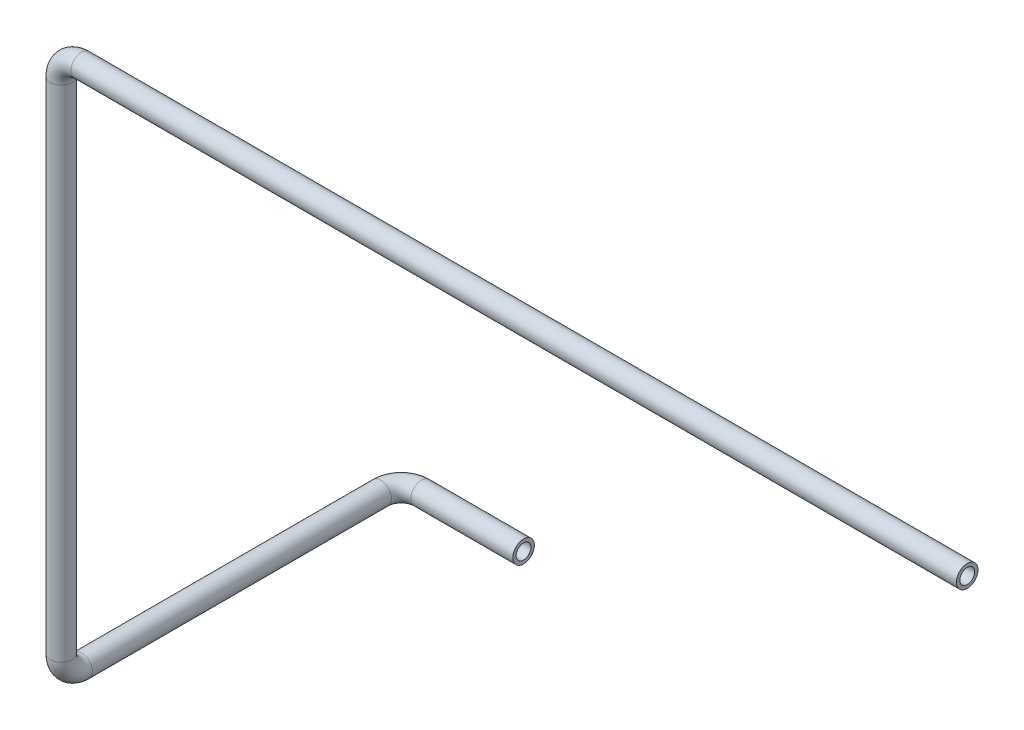
from build123d import *

# Parameters (mm, degrees)
TUBE_PROFILE_R   = 3.175
TUBE_PROFILE_R_2 = 2.175


with BuildPart() as part:
    # Tube: sweep along a curve in space
    with BuildLine() as tube_path:
        Line((76.5, 326, 150), (-184, 326, 150))
        ThreePointArc((-190, 320, 150), (-188.242640687, 324.242640687, 150), (-184, 326, 150))
        Line((-190, 320, 150), (-190, 173, 150))
        ThreePointArc((-190, 167, 144), (-190, 168.757359313, 148.242640687), (-190, 173, 150))
        Line((-190, 167, 144), (-190, 167, 56))
        ThreePointArc((-184, 167, 50), (-188.242640687, 167, 51.757359313), (-190, 167, 56))
        Line((-184, 167, 50), (-154, 167, 50))
    # Tube profile (on start of the path) → Tube (sweep)
    with BuildSketch(Plane(origin=(76.5, 326, 150), x_dir=(0, 0, -1), z_dir=(-1, 0, 0))):
        Circle(TUBE_PROFILE_R)
        Circle(TUBE_PROFILE_R_2, mode=Mode.SUBTRACT)
    sweep(path=tube_path.line)


solid = part.part
